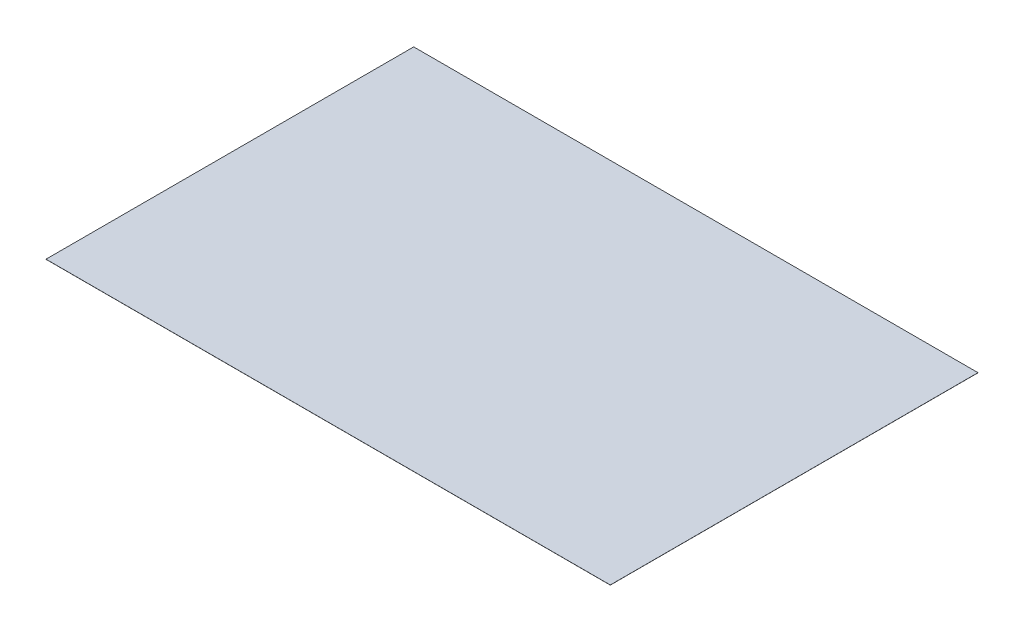
from build123d import *

# Parameters (mm, degrees)
SKETCH2_W           = 227.86
SKETCH2_H           = 148.48
BOSS_EXTRUDE1_DEPTH = 0.05


with BuildPart() as part:
    # Sketch2 → Boss-Extrude1 (new body)
    with BuildSketch(Plane(origin=(0, 0, 0), x_dir=(1, 0, 0), z_dir=(0, 1, 0))):
        with Locations((113.93, 74.24)):
            Rectangle(SKETCH2_W, SKETCH2_H)
    extrude(amount=BOSS_EXTRUDE1_DEPTH)


solid = part.part
